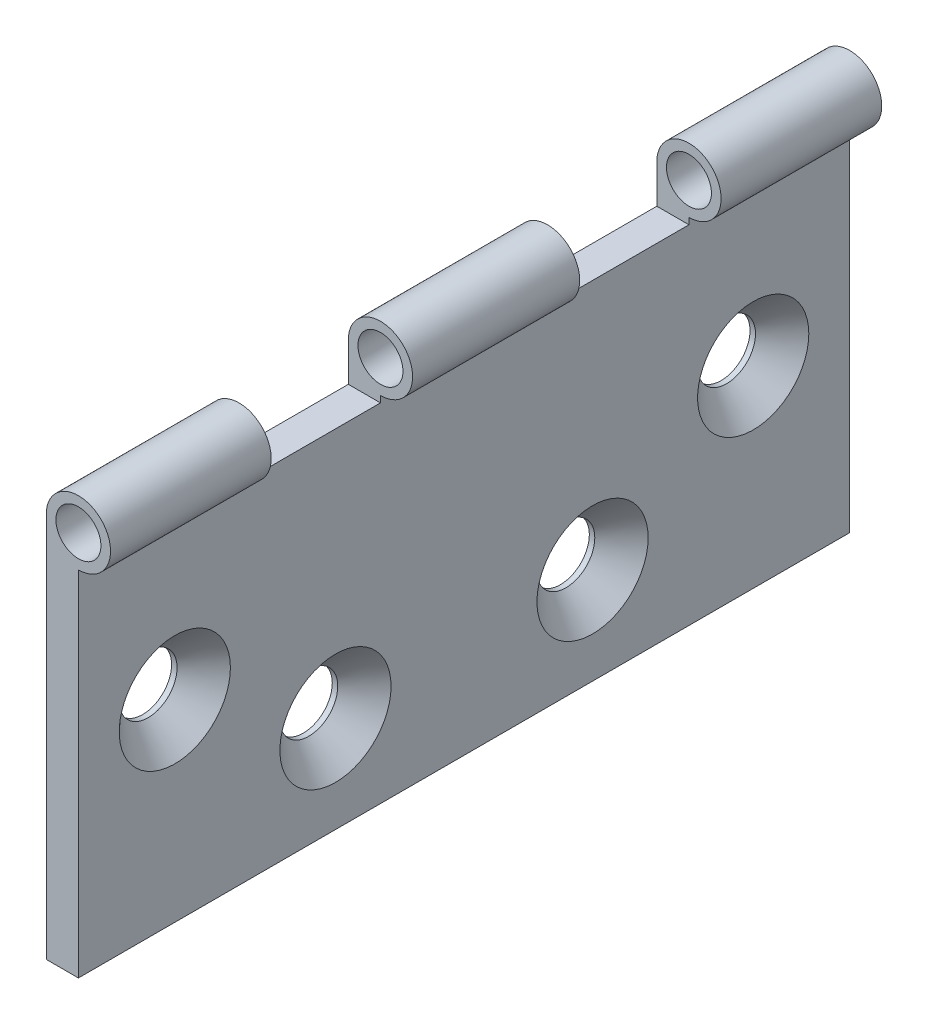
from build123d import *

# Parameters (mm, degrees)
SKETCH_1_W                 = 5
SKETCH_1_H                 = 60
EXTRUDE_1_DEPTH            = 60
SKETCH_2_R                 = 5
SKETCH_4_R                 = 3.5
CUT_EXTRUDE_1_DEPTH        = 137.839321834
HOLE_WIZARD_M81_AT_2_COUNT = 2
HOLE_WIZARD_M81_AT_2_PITCH = 29.154759474
CUT_EXTRUDE_3_DEPTH        = 89.600225733
CUT_EXTRUDE_3_DEPTH_BACK   = 89.600225733
SKETCH_8_W                 = 22
SKETCH_8_H                 = 11


with BuildPart() as part:
    # Эскиз1 → Вытянуть-Тонкостенный1 (new, symmetric)
    with BuildSketch(Plane.XY):
        with Locations((2.5, 30)):
            Rectangle(SKETCH_1_W, SKETCH_1_H)
    extrude(amount=EXTRUDE_1_DEPTH, both=True)

    # По траектории1: sweep along a curve in space
    with BuildLine() as sweep_1_path:
        Line((5, 60, 60), (5, 60, -60))
    # Эскиз2 → По траектории1 (sweep)
    with BuildSketch(Plane.XY.offset(60)):
        with Locations((5, 60)):
            Circle(SKETCH_2_R)
    sweep(path=sweep_1_path.line)

    # Эскиз4 → Вырез-Вытянуть1 (cut, through all)
    with BuildSketch(Plane.XY.offset(60)):
        with Locations((5, 60)):
            Circle(SKETCH_4_R)
    extrude(amount=-CUT_EXTRUDE_1_DEPTH, mode=Mode.SUBTRACT)

    # Эскиз5 → Зенковка для  винта с плоской головкой M81 (revolve, cut)
    with BuildSketch(Plane(origin=(5, 30, 45), x_dir=(0, 0, -1), z_dir=(0, 1, 0))):
        Polygon((0, 0), (0, 5), (4.5, 5), (4.5, 4.15), (8.65, 0), align=None)
    hole_wizard_m81 = revolve(axis=Axis((11.35, 30, 45), (-1, 0, 0)), mode=Mode.SUBTRACT)

    # Зенковка для  винта с плоской головкой M81 at 2: Зенковка для  винта с плоской головкой M81 ×2
    with Locations(*[Vector(0, -0.5144957554275265, -0.8574929257125442) * (i * HOLE_WIZARD_M81_AT_2_PITCH) for i in range(1, HOLE_WIZARD_M81_AT_2_COUNT)]):
        add(hole_wizard_m81, mode=Mode.SUBTRACT)

    # Зеркальное отражение1: Зенковка для  винта с плоской головкой M81 across plane
    add(hole_wizard_m81.mirror(Plane.XY), mode=Mode.SUBTRACT)

    # Зеркальное отражение1 copy 1 sketch → Зеркальное отражение1 copy 1 (revolve, cut)
    with BuildSketch(Plane(origin=(5, 15, -20), x_dir=(0, 0, 1), z_dir=(0, 1, 0))):
        Polygon((0, 0), (0, -5), (4.5, -5), (4.5, -4.15), (8.65, 0), align=None)
    revolve(axis=Axis((11.35, 15, -20), (1, 0, 0)), mode=Mode.SUBTRACT)

    # Эскиз8 → Вырез-Вытянуть3 (cut, two sides: drawn at the far end of the back side and taken through both)
    with BuildSketch(Plane(origin=(5, 0, 0), x_dir=(0, 0, -1), z_dir=(1, 0, 0)).offset(-CUT_EXTRUDE_3_DEPTH_BACK)):
        with Locations((-24, 59.5)):
            Rectangle(SKETCH_8_W, SKETCH_8_H)
        with Locations((24, 59.5)):
            Rectangle(SKETCH_8_W, SKETCH_8_H)
    extrude(amount=CUT_EXTRUDE_3_DEPTH + CUT_EXTRUDE_3_DEPTH_BACK, mode=Mode.SUBTRACT)


solid = part.part
